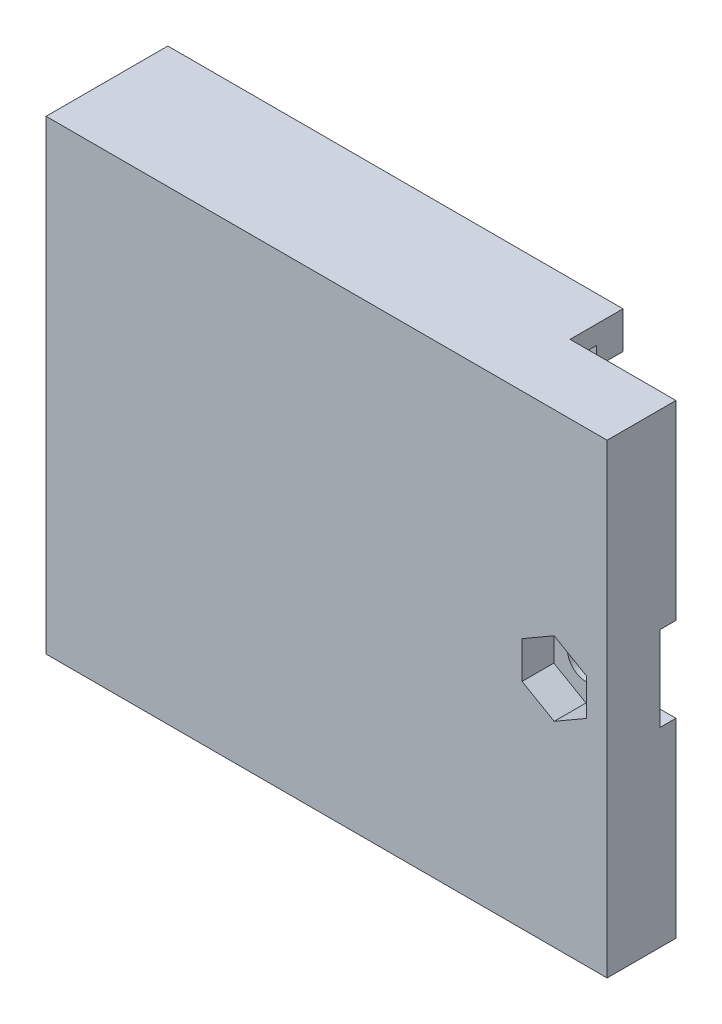
from build123d import *

# Parameters (mm, degrees)
CROQUIS1_W              = 53
CROQUIS1_H              = 44
CROQUIS1_R              = 1.75
SALIENTE_EXTRUIR1_DEPTH = 6.5
CROQUIS3_W              = 43
CROQUIS3_H              = 1.75
SALIENTE_EXTRUIR2_DEPTH = 5
CROQUIS4_W              = 43
CROQUIS4_H              = 1.75
SALIENTE_EXTRUIR3_DEPTH = 2.5
CROQUIS5_W              = 53
CROQUIS5_H              = 8
CORTAR_EXTRUIR2_DEPTH   = 1.5
CROQUIS8_W              = 2
CROQUIS8_H              = 8
SALIENTE_EXTRUIR6_DEPTH = 3
SALIENTE_EXTRUIR7_DEPTH = 8
CORTAR_EXTRUIR3_DEPTH   = 3


with BuildPart() as part:
    # Croquis1 → Saliente-Extruir1 (new body)
    with BuildSketch(Plane.XY):
        Rectangle(CROQUIS1_W, CROQUIS1_H)
        with Locations(Location((21.5, 0, 0), (0, 0, 180))):
            Circle(CROQUIS1_R, mode=Mode.SUBTRACT)
    extrude(amount=SALIENTE_EXTRUIR1_DEPTH)

    # Croquis3 → Saliente-Extruir2 (add)
    with BuildSketch(Plane(origin=(0, 0, 0), x_dir=(-1, 0, 0), z_dir=(0, 0, -1))):
        with Locations((5, -21.125)):
            Rectangle(CROQUIS3_W, CROQUIS3_H)
        with Locations((5, 21.125)):
            Rectangle(CROQUIS3_W, CROQUIS3_H)
    extrude(amount=SALIENTE_EXTRUIR2_DEPTH)

    # Croquis4 → Saliente-Extruir3 (add)
    with BuildSketch(Plane(origin=(0, 0, -5), x_dir=(-1, 0, 0), z_dir=(0, 0, -1))):
        with Locations((5, -19.375)):
            Rectangle(CROQUIS4_W, CROQUIS4_H)
        with Locations((5, 19.375)):
            Rectangle(CROQUIS4_W, CROQUIS4_H)
    extrude(amount=-SALIENTE_EXTRUIR3_DEPTH)

    # Croquis5 → Cortar-Extruir2 (cut)
    with BuildSketch(Plane(origin=(0, 0, 0), x_dir=(-1, 0, 0), z_dir=(0, 0, -1))):
        Rectangle(CROQUIS5_W, CROQUIS5_H)
    extrude(amount=-CORTAR_EXTRUIR2_DEPTH, mode=Mode.SUBTRACT)

    # Croquis8 → Saliente-Extruir6 (add)
    with BuildSketch(Plane(origin=(0, 0, 1.5), x_dir=(-1, 0, 0), z_dir=(0, 0, -1))):
        with Locations((25.5, 0)):
            Rectangle(CROQUIS8_W, CROQUIS8_H)
    extrude(amount=SALIENTE_EXTRUIR6_DEPTH)

    # Croquis9 → Saliente-Extruir7 (add)
    with BuildSketch(Plane.XZ.offset(-4)):
        Polygon((-24.5, 1.5), (-18.5, 1.5), (-24.5, 0.75), align=None)
    extrude(amount=SALIENTE_EXTRUIR7_DEPTH)

    # Croquis10 → Cortar-Extruir3 (cut)
    with BuildSketch(Plane.XY.offset(6.5)):
        Polygon((21.5, -3.5), (24.531088913, -1.75), (24.531088913, 1.75), (21.5, 3.5), (18.468911087, 1.75), (18.468911087, -1.75), align=None)
    extrude(amount=-CORTAR_EXTRUIR3_DEPTH, mode=Mode.SUBTRACT)


solid = part.part
